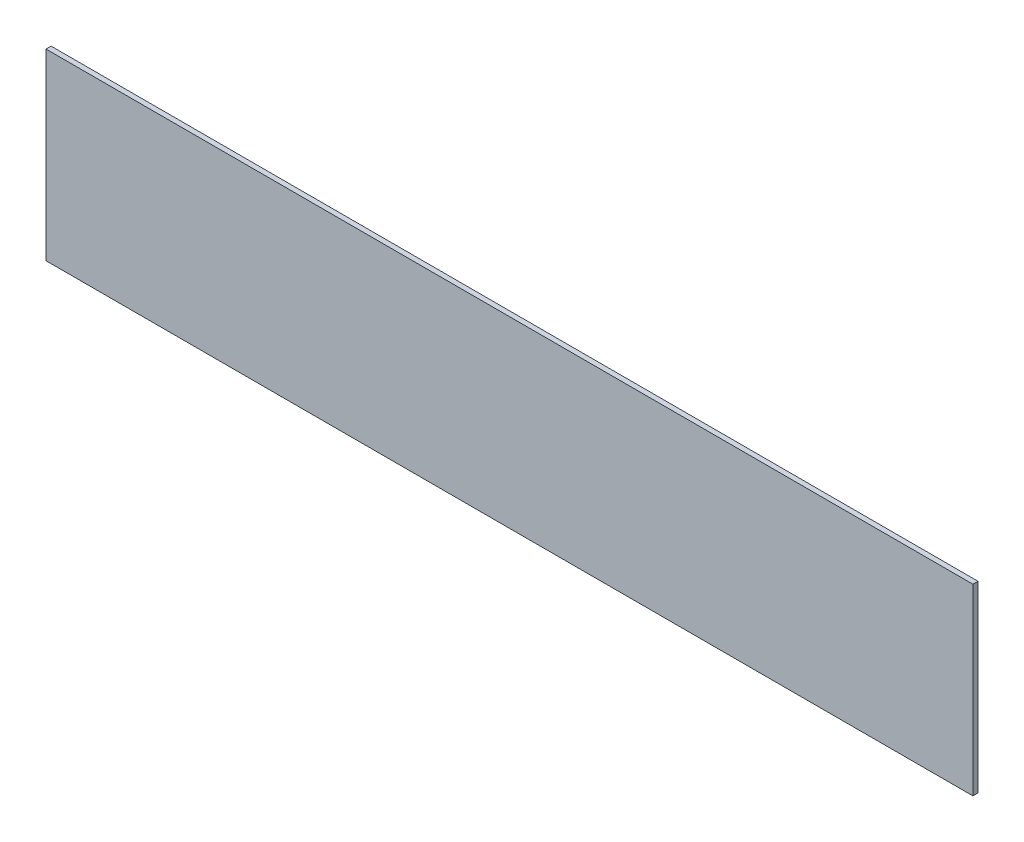
from build123d import *

# Parameters (mm, degrees)
TOPPING_KLAPE_ALT2_KULP_CUKURU_1_START = 26
SKETCH1_W                              = 182
SKETCH1_H                              = 36
TOPPING_KLAPE_ALT2_KULP_CUKURU_1_DEPTH = 1


with BuildPart() as part:
    # Sketch1 → TOPPING_klape_alt2_kulp_cukuru_1 (new body)
    with BuildSketch(Plane.XY.offset(TOPPING_KLAPE_ALT2_KULP_CUKURU_1_START)):
        with Locations((350, 330)):
            Rectangle(SKETCH1_W, SKETCH1_H)
    extrude(amount=TOPPING_KLAPE_ALT2_KULP_CUKURU_1_DEPTH)


solid = part.part
